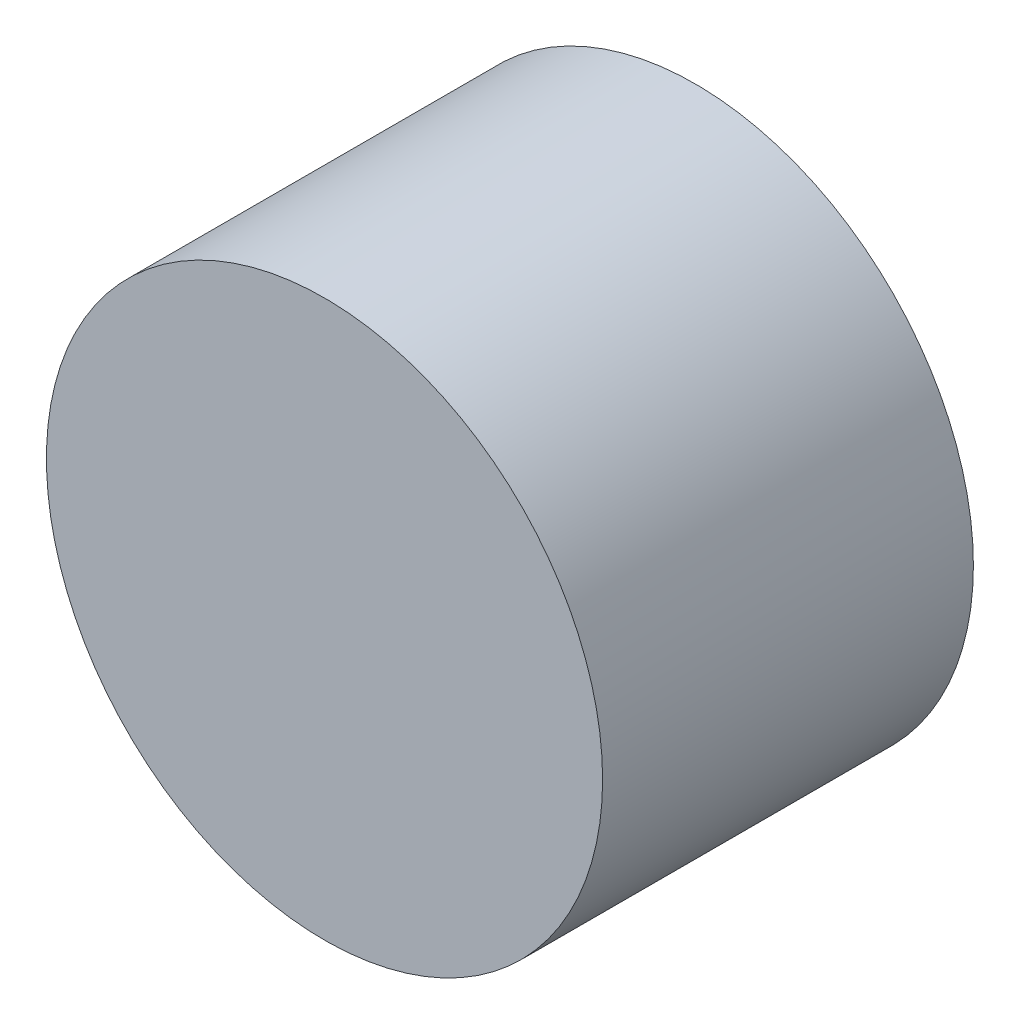
from build123d import *

# Parameters (mm, degrees)
SKETCH1_R           = 3
BOSS_EXTRUDE1_DEPTH = 4


with BuildPart() as part:
    # Sketch1 → Boss-Extrude1 (new body)
    with BuildSketch(Plane.XY):
        Circle(SKETCH1_R)
    extrude(amount=BOSS_EXTRUDE1_DEPTH)


solid = part.part
